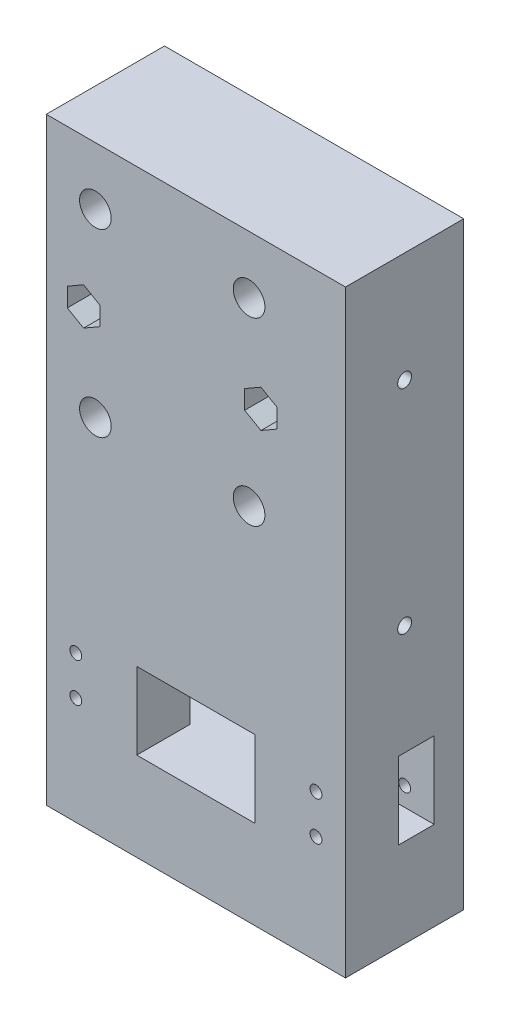
from build123d import *

# Parameters (mm, degrees)
SKETCH1_W               = 42.62295082
SKETCH1_H               = 50
SKETCH1_R               = 2.677018134
BOSS_EXTRUDE1_DEPTH     = 20
SKETCH2_R               = 11
CUT_EXTRUDE2_DEPTH      = 11
SKETCH3_R               = 1.75
CUT_EXTRUDE3_DEPTH      = 10
CUT_EXTRUDE6_START      = -5
CUT_EXTRUDE6_DEPTH      = 34.460095998
SKETCH30_W              = 42.62295082
SKETCH30_H              = 20
BOSS_EXTRUDE8_DEPTH     = 20.23
SKETCH10_W              = 42.62295082
SKETCH10_H              = 16
BOSS_EXTRUDE2_DEPTH     = 20
SKETCH14_W              = 6
SKETCH14_H              = 13
CUT_EXTRUDE7_DEPTH      = 78.238778062
BOSS_EXTRUDE3_DEPTH     = 8
CUT_EXTRUDE9_DEPTH      = 8
SKETCH18_W              = 0.9
SKETCH18_H              = 4
SKETCH18_W_2            = 1.8
CUT_EXTRUDE10_DEPTH     = 10.2
CUT_EXTRUDE8_DEPTH      = 71.769170482
CUT_EXTRUDE8_DEPTH_BACK = 71.769170482
SKETCH15_R              = 1
CUT_EXTRUDE5_DEPTH      = 82.374415455
CUT_EXTRUDE5_DEPTH_BACK = 50
SKETCH6_W               = 9.034037672
SKETCH6_H               = 5.5
SKETCH20_W              = 8
SKETCH20_H              = 20
BOSS_EXTRUDE5_DEPTH     = 13
SKETCH21_W              = 8
SKETCH21_H              = 6
CUT_EXTRUDE11_DEPTH     = 13
SKETCH22_R              = 1
CUT_EXTRUDE12_DEPTH     = 71.769170482
SKETCH24_W              = 50.62295082
SKETCH24_H              = 5
BOSS_EXTRUDE6_DEPTH     = 15
SKETCH25_W              = 50.62295082
SKETCH25_H              = 15
BOSS_EXTRUDE7_DEPTH     = 15
SKETCH26_R              = 1
CUT_EXTRUDE13_DEPTH     = 10
SKETCH27_W              = 4
SKETCH27_H              = 1.8
CUT_EXTRUDE14_DEPTH     = 10.2
SKETCH29_W              = 20
SKETCH29_H              = 3.2
CUT_EXTRUDE15_DEPTH     = 9


with BuildPart() as part:
    # Sketch1 → Boss-Extrude1 (new body)
    with BuildSketch(Plane.XY):
        Rectangle(SKETCH1_W, SKETCH1_H)
        with Locations((-13, -15.25)):
            Circle(SKETCH1_R, mode=Mode.SUBTRACT)
        with Locations(Location((13, -15.25, 0), (0, 0, 180))):
            Circle(SKETCH1_R, mode=Mode.SUBTRACT)
        with Locations((13, 15.25)):
            Circle(SKETCH1_R, mode=Mode.SUBTRACT)
        with Locations(Location((-13, 15.25, 0), (0, 0, 180))):
            Circle(SKETCH1_R, mode=Mode.SUBTRACT)
    extrude(amount=BOSS_EXTRUDE1_DEPTH)

    # Sketch2 → Cut-Extrude2 (cut)
    with BuildSketch(Plane.XY):
        Circle(SKETCH2_R)
    extrude(amount=CUT_EXTRUDE2_DEPTH, mode=Mode.SUBTRACT)

    # Sketch3 → Cut-Extrude3 (cut)
    with BuildSketch(Plane(origin=(0, 0, 0), x_dir=(-1, 0, 0), z_dir=(0, 0, -1))):
        with Locations((-15, 0)):
            Circle(SKETCH3_R)
        with Locations(Location((15, 0, 0), (0, 0, 180))):
            Circle(SKETCH3_R)
    extrude(amount=-CUT_EXTRUDE3_DEPTH, mode=Mode.SUBTRACT)

    # Sketch9 → Cut-Extrude6 (cut, through all)
    with BuildSketch(Plane(origin=(0, 0, 0), x_dir=(-1, 0, 0), z_dir=(0, 0, -1)).offset(CUT_EXTRUDE6_START)):
        Polygon((-15, 3.175426481), (-17.75, 1.58771324), (-17.75, -1.58771324), (-15, -3.175426481), (-12.25, -1.58771324), (-12.25, 1.58771324), align=None)
        Polygon((12.25, 1.58771324), (15, 3.175426481), (17.75, 1.58771324), (17.75, -1.58771324), (15, -3.175426481), (12.25, -1.58771324), align=None)
    extrude(amount=-CUT_EXTRUDE6_DEPTH, mode=Mode.SUBTRACT)

    # Sketch30 → Boss-Extrude8 (add)
    with BuildSketch(Plane.XZ.offset(25)):
        with Locations((0, 10)):
            Rectangle(SKETCH30_W, SKETCH30_H)
    extrude(amount=BOSS_EXTRUDE8_DEPTH)

    # Sketch10 → Boss-Extrude2 (add)
    with BuildSketch(Plane.XY):
        with Locations((0, -53.23)):
            Rectangle(SKETCH10_W, SKETCH10_H)
    extrude(amount=BOSS_EXTRUDE2_DEPTH)

    # Sketch14 → Cut-Extrude7 (cut, through all)
    with BuildSketch(Plane.ZY.offset(21.31147541)):
        with Locations((8, -54.73)):
            Rectangle(SKETCH14_W, SKETCH14_H)
    extrude(amount=-CUT_EXTRUDE7_DEPTH, mode=Mode.SUBTRACT)

    # Sketch16 → Boss-Extrude3 (add)
    with BuildSketch(Plane(origin=(21.31147541, 0, 0), x_dir=(0, 0, -1), z_dir=(1, 0, 0))):
        Polygon((-10, 25), (-10, -48.23), (-5, -48.23), (0, -48.23), (0, 25), align=None)
        Polygon((-11, -48.23), (-10, -48.23), (-10, 25), (-20, 25), (-20, -48.23), align=None)
    extrude(amount=BOSS_EXTRUDE3_DEPTH)

    # Sketch17 → Cut-Extrude9 (cut)
    with BuildSketch(Plane(origin=(29.31147541, 0, 0), x_dir=(0, 0, -1), z_dir=(1, 0, 0))):
        with BuildLine():
            ThreePointArc((-10, 7.56), (-11.175, 6.385), (-10, 5.21))
            Line((-10, 5.21), (-10, 7.56))
        make_face()
        with BuildLine():
            Line((-10, 7.56), (-10, 5.21))
            ThreePointArc((-10, 5.21), (-9.169149532, 5.554149532), (-8.825, 6.385))
            ThreePointArc((-8.825, 6.385), (-9.169149532, 7.215850468), (-10, 7.56))
        make_face()
        with BuildLine():
            ThreePointArc((-10, -28.44), (-11.175, -29.615), (-10, -30.79))
            Line((-10, -30.79), (-10, -28.44))
        make_face()
        with BuildLine():
            Line((-10, -28.44), (-10, -30.79))
            ThreePointArc((-10, -30.79), (-9.169149532, -30.445850468), (-8.825, -29.615))
            ThreePointArc((-8.825, -29.615), (-9.169149532, -28.784149532), (-10, -28.44))
        make_face()
    extrude(amount=-CUT_EXTRUDE9_DEPTH, mode=Mode.SUBTRACT)

    # Sketch18 → Cut-Extrude10 (cut)
    with BuildSketch(Plane(origin=(0, 0, 0), x_dir=(-1, 0, 0), z_dir=(0, 0, -1))):
        with Locations((-24.86147541, 6.385)):
            Rectangle(SKETCH18_W, SKETCH18_H)
        with Locations((-25.76147541, 6.385)):
            Rectangle(SKETCH18_W, SKETCH18_H)
        with Locations((-25.31147541, -29.615)):
            Rectangle(SKETCH18_W_2, SKETCH18_H)
    extrude(amount=-CUT_EXTRUDE10_DEPTH, mode=Mode.SUBTRACT)

    # Sketch15 → Cut-Extrude8 (cut, two sides: drawn at the far end of the back side and taken through both)
    with BuildSketch(Plane(origin=(0, 0, 0), x_dir=(-1, 0, 0), z_dir=(0, 0, -1)).offset(-CUT_EXTRUDE8_DEPTH_BACK)):
        with Locations(Location((16.31147541, -58.03, 0), (0, 0, 180))):
            Circle(SKETCH15_R)
        with Locations((16.31147541, -51.43)):
            Circle(SKETCH15_R)
    extrude(amount=CUT_EXTRUDE8_DEPTH + CUT_EXTRUDE8_DEPTH_BACK, mode=Mode.SUBTRACT)

    # Sketch6 → Cut-Extrude5 (cut, two sides: drawn at the far end of the back side and taken through both)
    with BuildSketch(Plane.XZ.offset(48.23).offset(-CUT_EXTRUDE5_DEPTH_BACK)):
        with Locations((0, 13.75)):
            Rectangle(SKETCH6_W, SKETCH6_H)
    extrude(amount=CUT_EXTRUDE5_DEPTH + CUT_EXTRUDE5_DEPTH_BACK, mode=Mode.SUBTRACT)

    # Sketch20 → Boss-Extrude5 (add)
    with BuildSketch(Plane(origin=(0, -48.23, 0), x_dir=(-1, 0, 0), z_dir=(0, -1, 0))):
        with Locations((-25.31147541, -10)):
            Rectangle(SKETCH20_W, SKETCH20_H)
    extrude(amount=BOSS_EXTRUDE5_DEPTH)

    # Sketch21 → Cut-Extrude11 (cut)
    with BuildSketch(Plane(origin=(0, -61.23, 0), x_dir=(-1, 0, 0), z_dir=(0, -1, 0))):
        with Locations((-25.31147541, -8)):
            Rectangle(SKETCH21_W, SKETCH21_H)
    extrude(amount=-CUT_EXTRUDE11_DEPTH, mode=Mode.SUBTRACT)

    # Sketch22 → Cut-Extrude12 (cut, through all)
    with BuildSketch(Plane(origin=(0, 0, 0), x_dir=(-1, 0, 0), z_dir=(0, 0, -1))):
        with Locations((-24.31147541, -58.03)):
            Circle(SKETCH22_R)
        with Locations((-24.31147541, -51.43)):
            Circle(SKETCH22_R)
    extrude(amount=-CUT_EXTRUDE12_DEPTH, mode=Mode.SUBTRACT)

    # Sketch24 → Boss-Extrude6 (add)
    with BuildSketch(Plane.XZ.offset(61.23)):
        with Locations((4, 2.5)):
            Rectangle(SKETCH24_W, SKETCH24_H)
    extrude(amount=BOSS_EXTRUDE6_DEPTH)

    # Sketch25 → Boss-Extrude7 (add)
    with BuildSketch(Plane.XY.offset(5)):
        with Locations((4, -68.73)):
            Rectangle(SKETCH25_W, SKETCH25_H)
    extrude(amount=BOSS_EXTRUDE7_DEPTH)

    # Sketch26 → Cut-Extrude13 (cut)
    with BuildSketch(Plane.XZ.offset(76.23)):
        with BuildLine():
            ThreePointArc((-15, 10), (-14, 9), (-13, 10))
            Line((-13, 10), (-15, 10))
        make_face()
        with BuildLine():
            Line((-15, 10), (-13, 10))
            ThreePointArc((-13, 10), (-14, 11), (-15, 10))
        make_face()
        with Locations(Location((22, 10, 0), (0, 0, 270))):
            Circle(SKETCH26_R)
    extrude(amount=-CUT_EXTRUDE13_DEPTH, mode=Mode.SUBTRACT)

    # Sketch27 → Cut-Extrude14 (cut)
    with BuildSketch(Plane(origin=(0, 0, 0), x_dir=(-1, 0, 0), z_dir=(0, 0, -1))):
        with Locations((-22.00147541, -72.23)):
            Rectangle(SKETCH27_W, SKETCH27_H)
        with Locations((14.00147541, -72.23)):
            Rectangle(SKETCH27_W, SKETCH27_H)
    extrude(amount=-CUT_EXTRUDE14_DEPTH, mode=Mode.SUBTRACT)

    # Sketch29 → Cut-Extrude15 (cut)
    with BuildSketch(Plane.XY.offset(20)):
        with Locations((4, -49.83)):
            Rectangle(SKETCH29_W, SKETCH29_H)
        Polygon((-6, -51.43), (-6, -53.105302663), (4, -54.73), (14, -53.105302663), (14, -51.43), align=None)
        Polygon((4, -54.73), (-6, -53.105302663), (-6, -56.354697337), align=None)
        with Locations((4, -59.63)):
            Rectangle(SKETCH29_W, SKETCH29_H)
        Polygon((14, -56.354697337), (4, -54.73), (-6, -56.354697337), (-6, -58.03), (14, -58.03), align=None)
        Polygon((14, -53.105302663), (4, -54.73), (14, -56.354697337), align=None)
    extrude(amount=-CUT_EXTRUDE15_DEPTH, mode=Mode.SUBTRACT)


solid = part.part
